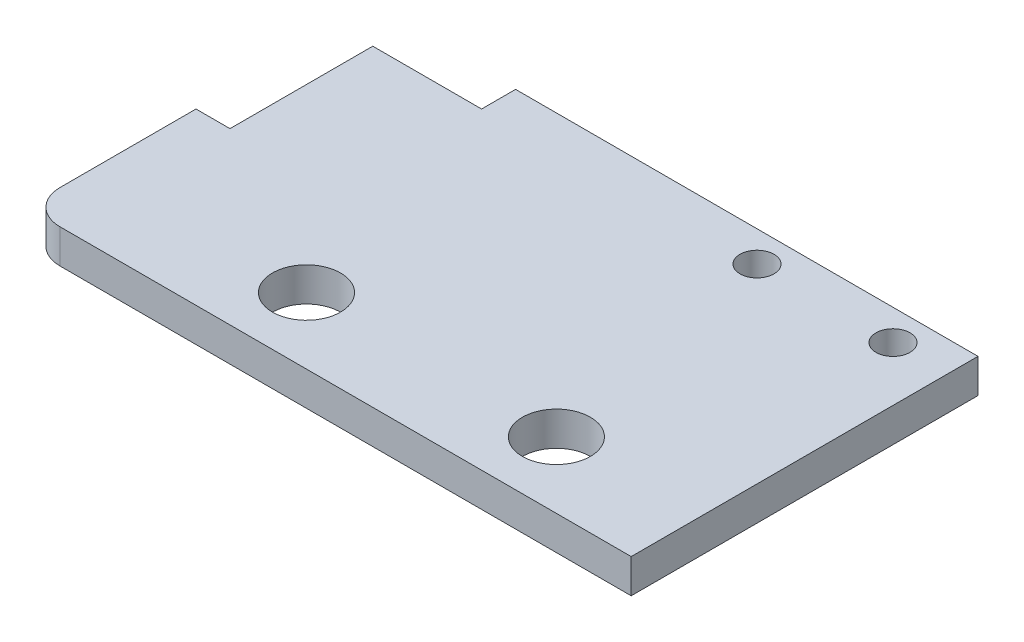
from build123d import *

# Parameters (mm, degrees)
DODANIE_WYCI_GNI_CIE1_DEPTH = 1
SZKIC2_R                    = 0.5
SZKIC2_R_2                  = 1
WYTNIJ_WYCI_GNI_CIE1_DEPTH  = 1
ZAOKR_GLENIE1_R             = 1
SZKIC3_W                    = 1
SZKIC3_H                    = 1
WYTNIJ_WYCI_GNI_CIE2_DEPTH  = 10


with BuildPart() as part:
    # Szkic1 → Dodanie-wyciągnięcie1 (new body)
    with BuildSketch(Plane(origin=(0, 0, 0), x_dir=(1, 0, 0), z_dir=(0, 1, 0))):
        Polygon((0, 0), (17.8, 0), (17.8, 10.2), (3.2, 10.2), (3.2, 9.2), (1, 9.2), (1, 5), (0, 5), align=None)
    extrude(amount=DODANIE_WYCI_GNI_CIE1_DEPTH)

    # Szkic2 → Wytnij-wyciągnięcie1 (cut)
    with BuildSketch(Plane(origin=(0, 1, 0), x_dir=(1, 0, 0), z_dir=(0, 1, 0))):
        with Locations(Location((12.2, 9.3, 0), (0, 0, 270))):
            Circle(SZKIC2_R)
        with Locations(Location((16.2, 9.3, 0), (0, 0, 270))):
            Circle(SZKIC2_R)
        with Locations(Location((6.3, 1.95, 0), (0, 0, 270))):
            Circle(SZKIC2_R_2)
        with Locations(Location((13.65, 1.95, 0), (0, 0, 270))):
            Circle(SZKIC2_R_2)
    extrude(amount=-WYTNIJ_WYCI_GNI_CIE1_DEPTH, mode=Mode.SUBTRACT)

    # Zaokrąglenie1
    zaokr_glenie1_edges = [part.edges().sort_by_distance(p)[0] for p in [
        (0, 0.5, 0),
    ]]
    fillet(zaokr_glenie1_edges, radius=ZAOKR_GLENIE1_R)

    # Szkic3 → Wytnij-wyciągnięcie2 (cut)
    with BuildSketch(Plane(origin=(0, 1, 0), x_dir=(1, 0, 0), z_dir=(0, 1, 0))):
        with Locations((3.7, 9.7)):
            Rectangle(SZKIC3_W, SZKIC3_H)
    extrude(amount=-WYTNIJ_WYCI_GNI_CIE2_DEPTH, mode=Mode.SUBTRACT)


solid = part.part
